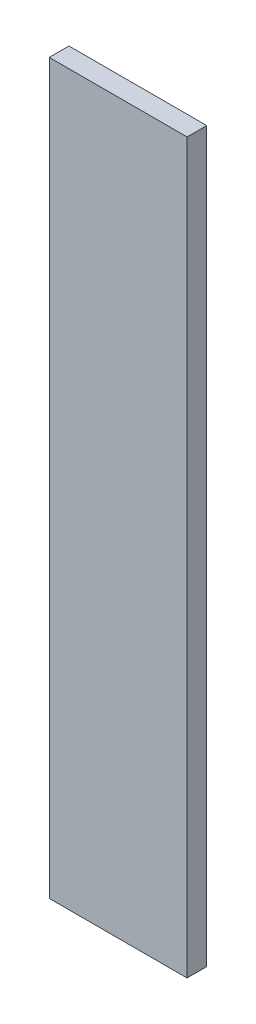
from build123d import *

# Parameters (mm, degrees)
SKETCH1_W           = 70
SKETCH1_H           = 370
BOSS_EXTRUDE1_DEPTH = 10


with BuildPart() as part:
    # Sketch1 → Boss-Extrude1 (new body)
    with BuildSketch(Plane.XY):
        with Locations((35, -185)):
            Rectangle(SKETCH1_W, SKETCH1_H)
    extrude(amount=BOSS_EXTRUDE1_DEPTH)


solid = part.part
